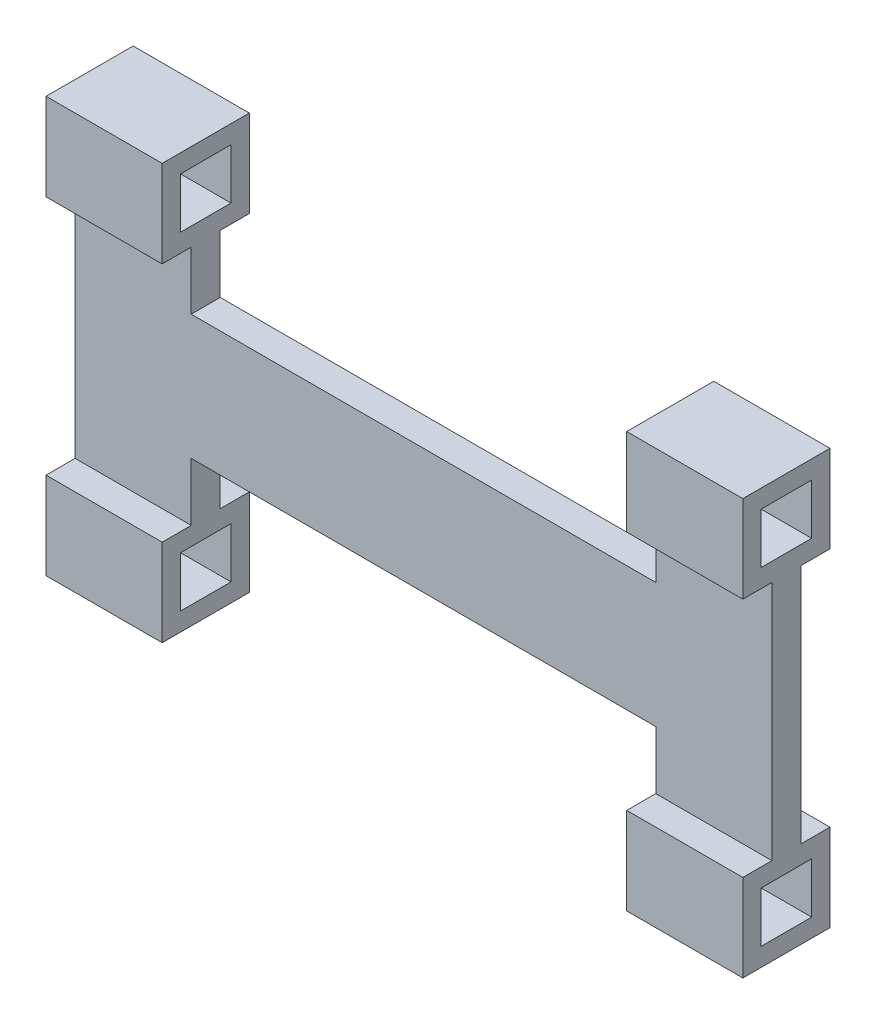
from build123d import *

# Parameters (mm, degrees)
SKETCH_1_W               = 1.74
SKETCH_1_H               = 1.74
SKETCH_1_W_2             = 3
SKETCH_1_H_2             = 3
EXTRUDE_1_DEPTH          = 24
CUT_EXTRUDE_1_DEPTH      = 28.241328896
CUT_EXTRUDE_1_DEPTH_BACK = 28.241328896
SKETCH_2_W               = 16
SKETCH_2_H               = 10


with BuildPart() as part:
    # 草图1 → 凸台-拉伸1 (new body)
    # profile 1 of 2: a face of its own
    with BuildSketch(Plane(origin=(0, 0, 0), x_dir=(0, 0, -1), z_dir=(1, 0, 0))):
        Polygon((0.5, 1.5), (0.5, 9.8), (1.5, 9.8), (1.5, 12.8), (-1.5, 12.8), (-1.5, 9.8), (-0.5, 9.8), (-0.5, 1.5), align=None)
        with Locations((0, 11.3)):
            Rectangle(SKETCH_1_W, SKETCH_1_H, mode=Mode.SUBTRACT)
    # profile 2 of 2: a face of its own
    with BuildSketch(Plane(origin=(0, 0, 0), x_dir=(0, 0, -1), z_dir=(1, 0, 0))):
        Rectangle(SKETCH_1_W_2, SKETCH_1_H_2)
        Rectangle(SKETCH_1_W, SKETCH_1_H, mode=Mode.SUBTRACT)
    extrude(amount=EXTRUDE_1_DEPTH)

    # 草图2 → 切除-拉伸1 (cut, two sides: drawn at the far end of the back side and taken through both)
    with BuildSketch(Plane.XY.offset(-CUT_EXTRUDE_1_DEPTH_BACK)):
        with Locations((12, 12.8)):
            Rectangle(SKETCH_2_W, SKETCH_2_H)
        with Locations((12, -1.5)):
            Rectangle(SKETCH_2_W, SKETCH_2_H)
    extrude(amount=CUT_EXTRUDE_1_DEPTH + CUT_EXTRUDE_1_DEPTH_BACK, mode=Mode.SUBTRACT)


solid = part.part
